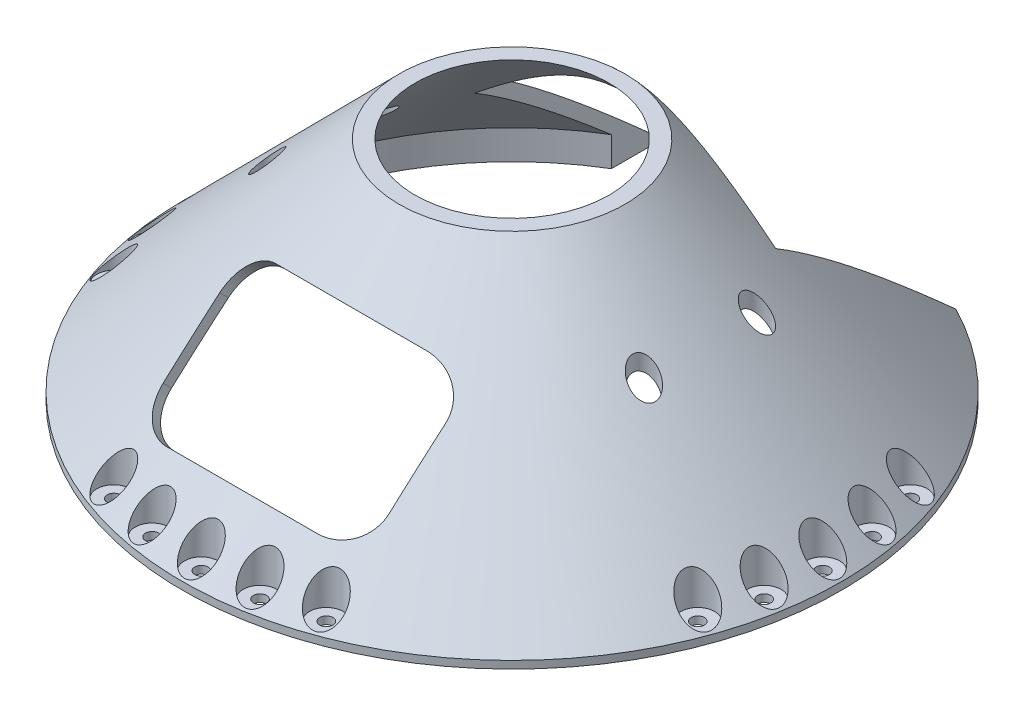
from build123d import *
from build123d.topology import SkipClean

# Parameters (mm, degrees)
SHELL1_T                        = -3
BOSS_EXTRUDE1_REACH             = 139.523
SKETCH2_R                       = 87.5
SKETCH2_R_2                     = 77.5
SKETCH3_W                       = 80
SKETCH3_H                       = 115
CUT_EXTRUDE1_DEPTH              = 138.522725395
SKETCH4_R                       = 4.5
CUT_EXTRUDE2_DEPTH              = 137.66199179
SKETCH5_R                       = 1.75
CUT_EXTRUDE3_DEPTH              = 137.66199196
CIRPATTERN1_COUNT               = 3
CIRPATTERN1_ANGLE               = 20
CIRPATTERN1_THE_OTHER_WAY_COUNT = 3
CIRPATTERN1_THE_OTHER_WAY_ANGLE = 20
CIRPATTERN2_COUNT               = 3
CIRPATTERN2_ANGLE               = 180
CIRPATTERN2_COPY_1_SKETCH_R     = 4.5
CIRPATTERN2_COPY_1_DEPTH        = 137.66199179
CIRPATTERN2_COPY_2_SKETCH_R     = 4.5
CIRPATTERN2_COPY_2_DEPTH        = 137.66199179
CIRPATTERN2_COPY_3_SKETCH_R     = 4.5
CIRPATTERN2_COPY_3_DEPTH        = 137.66199179
CIRPATTERN2_COPY_4_SKETCH_R     = 4.5
CIRPATTERN2_COPY_4_DEPTH        = 137.66199179
CIRPATTERN2_COPY_5_SKETCH_R     = 1.75
CIRPATTERN2_COPY_5_DEPTH        = 137.66199196
CIRPATTERN2_COPY_6_SKETCH_R     = 1.75
CIRPATTERN2_COPY_6_DEPTH        = 137.66199196
CIRPATTERN2_COPY_7_SKETCH_R     = 1.75
CIRPATTERN2_COPY_7_DEPTH        = 137.66199196
CIRPATTERN2_COPY_8_SKETCH_R     = 1.75
CIRPATTERN2_COPY_8_DEPTH        = 137.66199196
CIRPATTERN2_COPY_9_SKETCH_R     = 4.5
CIRPATTERN2_COPY_9_DEPTH        = 137.66199179
CIRPATTERN2_COPY_10_SKETCH_R    = 4.5
CIRPATTERN2_COPY_10_DEPTH       = 137.66199179
CIRPATTERN2_COPY_11_SKETCH_R    = 4.5
CIRPATTERN2_COPY_11_DEPTH       = 137.66199179
CIRPATTERN2_COPY_12_SKETCH_R    = 4.5
CIRPATTERN2_COPY_12_DEPTH       = 137.66199179
CIRPATTERN2_COPY_13_SKETCH_R    = 1.75
CIRPATTERN2_COPY_13_DEPTH       = 137.66199196
CIRPATTERN2_COPY_14_SKETCH_R    = 1.75
CIRPATTERN2_COPY_14_DEPTH       = 137.66199196
CIRPATTERN2_COPY_15_SKETCH_R    = 1.75
CIRPATTERN2_COPY_15_DEPTH       = 137.66199196
CIRPATTERN2_COPY_16_SKETCH_R    = 1.75
CIRPATTERN2_COPY_16_DEPTH       = 137.66199196
CUT_EXTRUDE4_DEPTH              = 138.522725566
SKETCH7_R                       = 3.5
CUT_EXTRUDE5_DEPTH              = 138.522725566


with BuildPart() as part:
    # Sketch1 → Revolve1 (revolve)
    with BuildSketch(Plane.XY, mode=Mode.PRIVATE) as revolve1_sk:
        Polygon((0, 0), (87.5, 0), (87.5, 2), (30, 60), (0, 60), align=None)
    revolve(revolve1_sk.sketch.rotate(Axis((0, 60, 0), (0, -1, 0)), 180), axis=Axis((0, 60, 0), (0, -1, 0)))

    # Shell1
    shell1_openings = [part.faces().sort_by_distance(p)[0] for p in [
        (0, 60, 0),
        (0, 0, 0),
    ]]
    offset(amount=SHELL1_T, openings=shell1_openings, kind=Kind.INTERSECTION)

    # Boss-Extrude1: up to this cone (the profile starts inside it)
    boss_extrude1_end = Plane(origin=(0, 0, 0), z_dir=(0, -1, 0)).offset(-85.999741687) * Cone(1e-06, 308.597650453, 311.281107283, align=(Align.CENTER, Align.CENTER, Align.MIN), mode=Mode.PRIVATE)
    # Sketch2 → Boss-Extrude1 (add, up to the surface)
    with BuildSketch(Plane(origin=(0, 0, 0), x_dir=(1, 0, 0), z_dir=(0, 1, 0)), mode=Mode.PRIVATE) as boss_extrude1_sk1:
        with Locations(Location((0, 0, 0), (0, 0, 180))):
            Circle(SKETCH2_R)
        Circle(SKETCH2_R_2, mode=Mode.SUBTRACT)
    boss_extrude1_tool1 = extrude(boss_extrude1_sk1.sketch, amount=BOSS_EXTRUDE1_REACH, mode=Mode.PRIVATE) & boss_extrude1_end
    add(boss_extrude1_tool1.solids().sort_by_distance((85.025126, 0, 0))[0])

    # Sketch3 → Cut-Extrude1 (cut, through all)
    with SkipClean():  # the faces are left unmerged after this step: merging them gives an invalid solid
        with BuildSketch(Plane(origin=(0, 0, 0), x_dir=(1, 0, 0), z_dir=(0, 1, 0))):
            with Locations((0, 87.5)):
                Rectangle(SKETCH3_W, SKETCH3_H)
        extrude(amount=CUT_EXTRUDE1_DEPTH, mode=Mode.SUBTRACT)

    # Sketch4 → Cut-Extrude2 (cut, through all)
    with SkipClean():  # the faces are left unmerged after this step: merging them gives an invalid solid
        with BuildSketch(Plane(origin=(0, 2, 0), x_dir=(1, 0, 0), z_dir=(0, 1, 0))):
            with Locations(Location((-82.5, 0, 0), (0, 0, 134.809260435))):
                Circle(SKETCH4_R)
        cut_extrude2 = extrude(amount=CUT_EXTRUDE2_DEPTH, mode=Mode.SUBTRACT)

    # Sketch5 → Cut-Extrude3 (cut, through all)
    with SkipClean():  # the faces are left unmerged after this step: merging them gives an invalid solid
        with BuildSketch(Plane(origin=(0, 2, 0), x_dir=(1, 0, 0), z_dir=(0, 1, 0))):
            with Locations(Location((-82.5, 0, 0), (0, 0, 270))):
                Circle(SKETCH5_R)
        cut_extrude3 = extrude(amount=-CUT_EXTRUDE3_DEPTH, mode=Mode.SUBTRACT)

    # CirPattern1: Cut-Extrude2, Cut-Extrude3 ×3 about axis
    with SkipClean():  # the faces are left unmerged after this step: merging them gives an invalid solid
        cirpattern1_axis = Axis((0, 0, 0), (0, 1, 0))
        add([cut_extrude2.rotate(cirpattern1_axis, i * CIRPATTERN1_ANGLE / (CIRPATTERN1_COUNT - 1)) for i in range(1, CIRPATTERN1_COUNT)], mode=Mode.SUBTRACT)
        add([cut_extrude3.rotate(cirpattern1_axis, i * CIRPATTERN1_ANGLE / (CIRPATTERN1_COUNT - 1)) for i in range(1, CIRPATTERN1_COUNT)], mode=Mode.SUBTRACT)

    # CirPattern1 the other way: Cut-Extrude2, Cut-Extrude3 ×3 about axis
    with SkipClean():  # the faces are left unmerged after this step: merging them gives an invalid solid
        cirpattern1_the_other_way_axis = Axis((0, 0, 0), (0, -1, 0))
        add([cut_extrude2.rotate(cirpattern1_the_other_way_axis, i * CIRPATTERN1_THE_OTHER_WAY_ANGLE / (CIRPATTERN1_THE_OTHER_WAY_COUNT - 1)) for i in range(1, CIRPATTERN1_THE_OTHER_WAY_COUNT)], mode=Mode.SUBTRACT)
        add([cut_extrude3.rotate(cirpattern1_the_other_way_axis, i * CIRPATTERN1_THE_OTHER_WAY_ANGLE / (CIRPATTERN1_THE_OTHER_WAY_COUNT - 1)) for i in range(1, CIRPATTERN1_THE_OTHER_WAY_COUNT)], mode=Mode.SUBTRACT)

    # CirPattern2: Cut-Extrude2, Cut-Extrude3 ×3 about axis
    with SkipClean():  # the faces are left unmerged after this step: merging them gives an invalid solid
        cirpattern2_axis = Axis((0, 2, 0), (0, 1, 0))
        add([cut_extrude2.rotate(cirpattern2_axis, i * CIRPATTERN2_ANGLE / (CIRPATTERN2_COUNT - 1)) for i in range(1, CIRPATTERN2_COUNT)], mode=Mode.SUBTRACT)
        add([cut_extrude3.rotate(cirpattern2_axis, i * CIRPATTERN2_ANGLE / (CIRPATTERN2_COUNT - 1)) for i in range(1, CIRPATTERN2_COUNT)], mode=Mode.SUBTRACT)

    # CirPattern2 copy 1 sketch → CirPattern2 copy 1 (cut, through all)
    with SkipClean():  # the faces are left unmerged after this step: merging them gives an invalid solid
        with BuildSketch(Plane(origin=(0, 2, 0), x_dir=(-0.1736481776669342, 0, -0.9848077530122075), z_dir=(0, 1, 0))):
            with Locations(Location((-82.5, 0, 0), (0, 0, 134.809260435))):
                Circle(CIRPATTERN2_COPY_1_SKETCH_R)
        extrude(amount=CIRPATTERN2_COPY_1_DEPTH, mode=Mode.SUBTRACT)

    # CirPattern2 copy 2 sketch → CirPattern2 copy 2 (cut, through all)
    with SkipClean():  # the faces are left unmerged after this step: merging them gives an invalid solid
        with BuildSketch(Plane(origin=(0, 2, 0), x_dir=(-0.9848077530122068, 0, 0.17364817766693763), z_dir=(0, 1, 0))):
            with Locations(Location((-82.5, 0, 0), (0, 0, 134.809260435))):
                Circle(CIRPATTERN2_COPY_2_SKETCH_R)
        extrude(amount=CIRPATTERN2_COPY_2_DEPTH, mode=Mode.SUBTRACT)

    # CirPattern2 copy 3 sketch → CirPattern2 copy 3 (cut, through all)
    with SkipClean():  # the faces are left unmerged after this step: merging them gives an invalid solid
        with BuildSketch(Plane(origin=(0, 2, 0), x_dir=(-0.34202014332567277, 0, -0.9396926207859069), z_dir=(0, 1, 0))):
            with Locations(Location((-82.5, 0, 0), (0, 0, 134.809260435))):
                Circle(CIRPATTERN2_COPY_3_SKETCH_R)
        extrude(amount=CIRPATTERN2_COPY_3_DEPTH, mode=Mode.SUBTRACT)

    # CirPattern2 copy 4 sketch → CirPattern2 copy 4 (cut, through all)
    with SkipClean():  # the faces are left unmerged after this step: merging them gives an invalid solid
        with BuildSketch(Plane(origin=(0, 2, 0), x_dir=(-0.9396926207859057, 0, 0.34202014332567604), z_dir=(0, 1, 0))):
            with Locations(Location((-82.5, 0, 0), (0, 0, 134.809260435))):
                Circle(CIRPATTERN2_COPY_4_SKETCH_R)
        extrude(amount=CIRPATTERN2_COPY_4_DEPTH, mode=Mode.SUBTRACT)

    # CirPattern2 copy 5 sketch → CirPattern2 copy 5 (cut, through all)
    with SkipClean():  # the faces are left unmerged after this step: merging them gives an invalid solid
        with BuildSketch(Plane(origin=(0, 2, 0), x_dir=(-0.1736481776669342, 0, -0.9848077530122075), z_dir=(0, 1, 0))):
            with Locations(Location((-82.5, 0, 0), (0, 0, 270))):
                Circle(CIRPATTERN2_COPY_5_SKETCH_R)
        extrude(amount=-CIRPATTERN2_COPY_5_DEPTH, mode=Mode.SUBTRACT)

    # CirPattern2 copy 6 sketch → CirPattern2 copy 6 (cut, through all)
    with SkipClean():  # the faces are left unmerged after this step: merging them gives an invalid solid
        with BuildSketch(Plane(origin=(0, 2, 0), x_dir=(-0.9848077530122068, 0, 0.17364817766693763), z_dir=(0, 1, 0))):
            with Locations(Location((-82.5, 0, 0), (0, 0, 270))):
                Circle(CIRPATTERN2_COPY_6_SKETCH_R)
        extrude(amount=-CIRPATTERN2_COPY_6_DEPTH, mode=Mode.SUBTRACT)

    # CirPattern2 copy 7 sketch → CirPattern2 copy 7 (cut, through all)
    with SkipClean():  # the faces are left unmerged after this step: merging them gives an invalid solid
        with BuildSketch(Plane(origin=(0, 2, 0), x_dir=(-0.34202014332567277, 0, -0.9396926207859069), z_dir=(0, 1, 0))):
            with Locations(Location((-82.5, 0, 0), (0, 0, 270))):
                Circle(CIRPATTERN2_COPY_7_SKETCH_R)
        extrude(amount=-CIRPATTERN2_COPY_7_DEPTH, mode=Mode.SUBTRACT)

    # CirPattern2 copy 8 sketch → CirPattern2 copy 8 (cut, through all)
    with SkipClean():  # the faces are left unmerged after this step: merging them gives an invalid solid
        with BuildSketch(Plane(origin=(0, 2, 0), x_dir=(-0.9396926207859057, 0, 0.34202014332567604), z_dir=(0, 1, 0))):
            with Locations(Location((-82.5, 0, 0), (0, 0, 270))):
                Circle(CIRPATTERN2_COPY_8_SKETCH_R)
        extrude(amount=-CIRPATTERN2_COPY_8_DEPTH, mode=Mode.SUBTRACT)

    # CirPattern2 copy 9 sketch → CirPattern2 copy 9 (cut, through all)
    with SkipClean():  # the faces are left unmerged after this step: merging them gives an invalid solid
        with BuildSketch(Plane(origin=(0, 2, 0), x_dir=(0.1736481776669273, 0, -0.9848077530122086), z_dir=(0, 1, 0))):
            with Locations(Location((-82.5, 0, 0), (0, 0, 134.809260435))):
                Circle(CIRPATTERN2_COPY_9_SKETCH_R)
        extrude(amount=CIRPATTERN2_COPY_9_DEPTH, mode=Mode.SUBTRACT)

    # CirPattern2 copy 10 sketch → CirPattern2 copy 10 (cut, through all)
    with SkipClean():  # the faces are left unmerged after this step: merging them gives an invalid solid
        with BuildSketch(Plane(origin=(0, 2, 0), x_dir=(-0.9848077530122092, 0, -0.17364817766692386), z_dir=(0, 1, 0))):
            with Locations(Location((-82.5, 0, 0), (0, 0, 134.809260435))):
                Circle(CIRPATTERN2_COPY_10_SKETCH_R)
        extrude(amount=CIRPATTERN2_COPY_10_DEPTH, mode=Mode.SUBTRACT)

    # CirPattern2 copy 11 sketch → CirPattern2 copy 11 (cut, through all)
    with SkipClean():  # the faces are left unmerged after this step: merging them gives an invalid solid
        with BuildSketch(Plane(origin=(0, 2, 0), x_dir=(0.3420201433256662, 0, -0.9396926207859093), z_dir=(0, 1, 0))):
            with Locations(Location((-82.5, 0, 0), (0, 0, 134.809260435))):
                Circle(CIRPATTERN2_COPY_11_SKETCH_R)
        extrude(amount=CIRPATTERN2_COPY_11_DEPTH, mode=Mode.SUBTRACT)

    # CirPattern2 copy 12 sketch → CirPattern2 copy 12 (cut, through all)
    with SkipClean():  # the faces are left unmerged after this step: merging them gives an invalid solid
        with BuildSketch(Plane(origin=(0, 2, 0), x_dir=(-0.9396926207859105, 0, -0.34202014332566294), z_dir=(0, 1, 0))):
            with Locations(Location((-82.5, 0, 0), (0, 0, 134.809260435))):
                Circle(CIRPATTERN2_COPY_12_SKETCH_R)
        extrude(amount=CIRPATTERN2_COPY_12_DEPTH, mode=Mode.SUBTRACT)

    # CirPattern2 copy 13 sketch → CirPattern2 copy 13 (cut, through all)
    with SkipClean():  # the faces are left unmerged after this step: merging them gives an invalid solid
        with BuildSketch(Plane(origin=(0, 2, 0), x_dir=(0.1736481776669273, 0, -0.9848077530122086), z_dir=(0, 1, 0))):
            with Locations(Location((-82.5, 0, 0), (0, 0, 270))):
                Circle(CIRPATTERN2_COPY_13_SKETCH_R)
        extrude(amount=-CIRPATTERN2_COPY_13_DEPTH, mode=Mode.SUBTRACT)

    # CirPattern2 copy 14 sketch → CirPattern2 copy 14 (cut, through all)
    with SkipClean():  # the faces are left unmerged after this step: merging them gives an invalid solid
        with BuildSketch(Plane(origin=(0, 2, 0), x_dir=(-0.9848077530122092, 0, -0.17364817766692386), z_dir=(0, 1, 0))):
            with Locations(Location((-82.5, 0, 0), (0, 0, 270))):
                Circle(CIRPATTERN2_COPY_14_SKETCH_R)
        extrude(amount=-CIRPATTERN2_COPY_14_DEPTH, mode=Mode.SUBTRACT)

    # CirPattern2 copy 15 sketch → CirPattern2 copy 15 (cut, through all)
    with SkipClean():  # the faces are left unmerged after this step: merging them gives an invalid solid
        with BuildSketch(Plane(origin=(0, 2, 0), x_dir=(0.3420201433256662, 0, -0.9396926207859093), z_dir=(0, 1, 0))):
            with Locations(Location((-82.5, 0, 0), (0, 0, 270))):
                Circle(CIRPATTERN2_COPY_15_SKETCH_R)
        extrude(amount=-CIRPATTERN2_COPY_15_DEPTH, mode=Mode.SUBTRACT)

    # CirPattern2 copy 16 sketch → CirPattern2 copy 16 (cut, through all)
    with SkipClean():  # the faces are left unmerged after this step: merging them gives an invalid solid
        with BuildSketch(Plane(origin=(0, 2, 0), x_dir=(-0.9396926207859105, 0, -0.34202014332566294), z_dir=(0, 1, 0))):
            with Locations(Location((-82.5, 0, 0), (0, 0, 270))):
                Circle(CIRPATTERN2_COPY_16_SKETCH_R)
        extrude(amount=-CIRPATTERN2_COPY_16_DEPTH, mode=Mode.SUBTRACT)

    # Sketch6 → Cut-Extrude4 (cut, through all)
    with SkipClean():  # the faces are left unmerged after this step: merging them gives an invalid solid
        with BuildSketch(Plane(origin=(0, 0, 0), x_dir=(1, 0, 0), z_dir=(0, 0.7071067811865475, 0.7071067811865477))):
            with BuildLine():
                Line((-20, -40), (20, -40))
                ThreePointArc((20, -40), (27.071067812, -37.071067812), (30, -30))
                Line((30, -30), (30, -10))
                ThreePointArc((30, -10), (27.071067812, -2.928932188), (20, 0))
                Line((20, 0), (-20, 0))
                ThreePointArc((-20, 0), (-27.071067812, -2.928932188), (-30, -10))
                Line((-30, -10), (-30, -30))
                ThreePointArc((-30, -30), (-27.071067812, -37.071067812), (-20, -40))
            make_face()
        extrude(amount=CUT_EXTRUDE4_DEPTH, mode=Mode.SUBTRACT)

    # Sketch7 → Cut-Extrude5 (cut, through all)
    with SkipClean():  # the faces are left unmerged after this step: merging them gives an invalid solid
        with BuildSketch(Plane(origin=(0, 0, 0), x_dir=(1, 0, 0), z_dir=(0, 1, 0))):
            with Locations(Location((-50, 15, 0), (0, 0, 148.42137622))):
                Circle(SKETCH7_R)
            with Locations(Location((-50, -15, 0), (0, 0, 157.603777051))):
                Circle(SKETCH7_R)
            with Locations(Location((50, -15, 0), (0, 0, 84.627073289))):
                Circle(SKETCH7_R)
            with Locations(Location((50, 15, 0), (0, 0, 121.204646435))):
                Circle(SKETCH7_R)
            with Locations((15, -50)):
                Circle(SKETCH7_R)
            with Locations((-15, -50)):
                Circle(SKETCH7_R)
        extrude(amount=CUT_EXTRUDE5_DEPTH, mode=Mode.SUBTRACT)


solid = part.part
